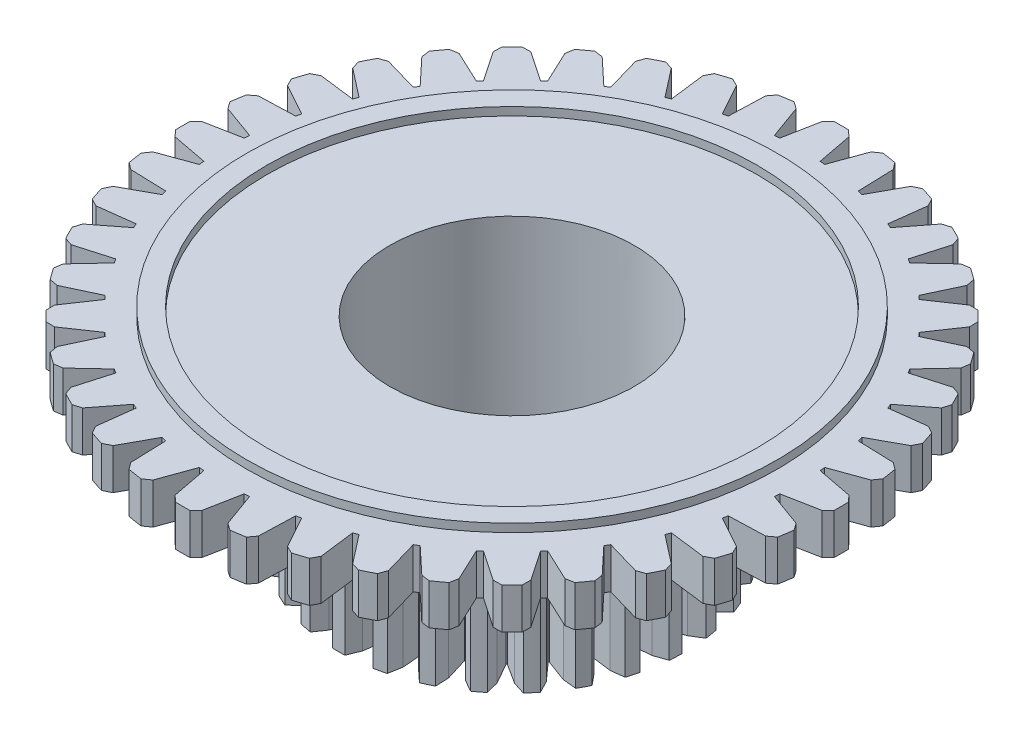
from build123d import *

# Parameters (mm, degrees)
BOSS_EXTRUDE1_DEPTH = 1
SKETCH2_R           = 6.500405198
SKETCH2_R_2         = 6.000405198
BOSS_EXTRUDE2_DEPTH = 0.2
SKETCH4_R           = 2.995
CUT_EXTRUDE3_DEPTH  = 4.2
SKETCH6_R           = 2.995
BOSS_EXTRUDE4_DEPTH = 4


with BuildPart() as part:
    # Sketch1 → Boss-Extrude1 (new body)
    with BuildSketch(Plane(origin=(0, 0, 0), x_dir=(1, 0, 0), z_dir=(0, 1, 0))):
        with BuildLine():
            Line((-0.176242376, 8.068075274), (-0.326242376, 7.922481316))
            Line((-0.326242376, 7.922481316), (-0.493178269, 7.052777835))
            ThreePointArc((-0.493178269, 7.052777835), (-0.554705807, 7.048205549), (-0.616191101, 7.043096516))
            Line((-0.616191101, 7.043096516), (-0.917123335, 7.875977976))
            Line((-0.917123335, 7.875977976), (-1.088052499, 7.996314261))
            ThreePointArc((-1.088052499, 7.996314261), (-1.262426133, 7.970644909), (-1.43619758, 7.941173497))
            Line((-1.43619758, 7.941173497), (-1.561574918, 7.773906872))
            Line((-1.561574918, 7.773906872), (-1.590403954, 6.888796358))
            ThreePointArc((-1.590403954, 6.888796358), (-1.650458722, 6.874655337), (-1.710387802, 6.859990785))
            Line((-1.710387802, 6.859990785), (-2.137906426, 7.635541919))
            Line((-2.137906426, 7.635541919), (-2.325555911, 7.727657453))
            ThreePointArc((-2.325555911, 7.727657453), (-2.493767145, 7.675026087), (-2.660788832, 7.618733674))
            Line((-2.660788832, 7.618733674), (-2.758456302, 7.433913042))
            Line((-2.758456302, 7.433913042), (-2.648468615, 6.555189852))
            ThreePointArc((-2.648468615, 6.555189852), (-2.705571867, 6.531828295), (-2.762469078, 6.507969314))
            Line((-2.762469078, 6.507969314), (-3.306047166, 7.207093479))
            Line((-3.306047166, 7.207093479), (-3.505796418, 7.268720071))
            ThreePointArc((-3.505796418, 7.268720071), (-3.663703333, 7.19042265), (-3.819862633, 7.108695342))
            Line((-3.819862633, 7.108695342), (-3.887415337, 6.910871601))
            Line((-3.887415337, 6.910871601), (-3.64131919, 6.060172816))
            ThreePointArc((-3.64131919, 6.060172816), (-3.694064853, 6.028165962), (-3.746529198, 5.99570004))
            Line((-3.746529198, 5.99570004), (-4.392782052, 6.601182479))
            Line((-4.392782052, 6.601182479), (-4.599712583, 6.630802678))
            ThreePointArc((-4.599712583, 6.630802678), (-4.743426986, 6.528767145), (-4.884878738, 6.423617339))
            Line((-4.884878738, 6.423617339), (-4.920653306, 6.217661565))
            Line((-4.920653306, 6.217661565), (-4.5445084, 5.415934213))
            ThreePointArc((-4.5445084, 5.415934213), (-4.591597702, 5.376070177), (-4.638337335, 5.335796732))
            Line((-4.638337335, 5.335796732), (-5.371352066, 5.832728459))
            Line((-5.371352066, 5.832728459), (-5.580368558, 5.829612917))
            ThreePointArc((-5.580368558, 5.829612917), (-5.706351724, 5.706351724), (-5.829612917, 5.580368558))
            Line((-5.829612917, 5.580368558), (-5.832728459, 5.371352066))
            Line((-5.832728459, 5.371352066), (-5.335796732, 4.638337335))
            ThreePointArc((-5.335796732, 4.638337335), (-5.376070177, 4.591597702), (-5.415934213, 4.5445084))
            Line((-5.415934213, 4.5445084), (-6.217661565, 4.920653306))
            Line((-6.217661565, 4.920653306), (-6.423617339, 4.884878738))
            ThreePointArc((-6.423617339, 4.884878738), (-6.528767145, 4.743426986), (-6.630802678, 4.599712583))
            Line((-6.630802678, 4.599712583), (-6.601182479, 4.392782052))
            Line((-6.601182479, 4.392782052), (-5.99570004, 3.746529198))
            ThreePointArc((-5.99570004, 3.746529198), (-6.028165962, 3.694064853), (-6.060172816, 3.64131919))
            Line((-6.060172816, 3.64131919), (-6.910871601, 3.887415337))
            Line((-6.910871601, 3.887415337), (-7.108695342, 3.819862633))
            ThreePointArc((-7.108695342, 3.819862633), (-7.19042265, 3.663703333), (-7.268720071, 3.505796418))
            Line((-7.268720071, 3.505796418), (-7.207093479, 3.306047166))
            Line((-7.207093479, 3.306047166), (-6.507969314, 2.762469078))
            ThreePointArc((-6.507969314, 2.762469078), (-6.531828295, 2.705571867), (-6.555189852, 2.648468615))
            Line((-6.555189852, 2.648468615), (-7.433913042, 2.758456302))
            Line((-7.433913042, 2.758456302), (-7.618733674, 2.660788832))
            ThreePointArc((-7.618733674, 2.660788832), (-7.675026087, 2.493767145), (-7.727657453, 2.325555911))
            Line((-7.727657453, 2.325555911), (-7.635541919, 2.137906426))
            Line((-7.635541919, 2.137906426), (-6.859990785, 1.710387802))
            ThreePointArc((-6.859990785, 1.710387802), (-6.874655337, 1.650458722), (-6.888796358, 1.590403954))
            Line((-6.888796358, 1.590403954), (-7.773906872, 1.561574918))
            Line((-7.773906872, 1.561574918), (-7.941173497, 1.43619758))
            ThreePointArc((-7.941173497, 1.43619758), (-7.970644909, 1.262426133), (-7.996314261, 1.088052499))
            Line((-7.996314261, 1.088052499), (-7.875977976, 0.917123335))
            Line((-7.875977976, 0.917123335), (-7.043096516, 0.616191101))
            ThreePointArc((-7.043096516, 0.616191101), (-7.048205549, 0.554705807), (-7.052777835, 0.493178269))
            Line((-7.052777835, 0.493178269), (-7.922481316, 0.326242376))
            Line((-7.922481316, 0.326242376), (-8.068075274, 0.176242376))
            ThreePointArc((-8.068075274, 0.176242376), (-8.07, 0), (-8.068075274, -0.176242376))
            Line((-8.068075274, -0.176242376), (-7.922481316, -0.326242376))
            Line((-7.922481316, -0.326242376), (-7.052777835, -0.493178269))
            ThreePointArc((-7.052777835, -0.493178269), (-7.048205549, -0.554705807), (-7.043096516, -0.616191101))
            Line((-7.043096516, -0.616191101), (-7.875977976, -0.917123335))
            Line((-7.875977976, -0.917123335), (-7.996314261, -1.088052499))
            ThreePointArc((-7.996314261, -1.088052499), (-7.970644909, -1.262426133), (-7.941173497, -1.43619758))
            Line((-7.941173497, -1.43619758), (-7.773906872, -1.561574918))
            Line((-7.773906872, -1.561574918), (-6.888796358, -1.590403954))
            ThreePointArc((-6.888796358, -1.590403954), (-6.874655337, -1.650458722), (-6.859990785, -1.710387802))
            Line((-6.859990785, -1.710387802), (-7.635541919, -2.137906426))
            Line((-7.635541919, -2.137906426), (-7.727657453, -2.325555911))
            ThreePointArc((-7.727657453, -2.325555911), (-7.675026087, -2.493767145), (-7.618733674, -2.660788832))
            Line((-7.618733674, -2.660788832), (-7.433913042, -2.758456302))
            Line((-7.433913042, -2.758456302), (-6.555189852, -2.648468615))
            ThreePointArc((-6.555189852, -2.648468615), (-6.531828295, -2.705571867), (-6.507969314, -2.762469078))
            Line((-6.507969314, -2.762469078), (-7.207093479, -3.306047166))
            Line((-7.207093479, -3.306047166), (-7.268720071, -3.505796418))
            ThreePointArc((-7.268720071, -3.505796418), (-7.19042265, -3.663703333), (-7.108695342, -3.819862633))
            Line((-7.108695342, -3.819862633), (-6.910871601, -3.887415337))
            Line((-6.910871601, -3.887415337), (-6.060172816, -3.64131919))
            ThreePointArc((-6.060172816, -3.64131919), (-6.028165962, -3.694064853), (-5.99570004, -3.746529198))
            Line((-5.99570004, -3.746529198), (-6.601182479, -4.392782052))
            Line((-6.601182479, -4.392782052), (-6.630802678, -4.599712583))
            ThreePointArc((-6.630802678, -4.599712583), (-6.528767145, -4.743426986), (-6.423617339, -4.884878738))
            Line((-6.423617339, -4.884878738), (-6.217661565, -4.920653306))
            Line((-6.217661565, -4.920653306), (-5.415934213, -4.5445084))
            ThreePointArc((-5.415934213, -4.5445084), (-5.376070177, -4.591597702), (-5.335796732, -4.638337335))
            Line((-5.335796732, -4.638337335), (-5.832728459, -5.371352066))
            Line((-5.832728459, -5.371352066), (-5.829612917, -5.580368558))
            ThreePointArc((-5.829612917, -5.580368558), (-5.706351724, -5.706351724), (-5.580368558, -5.829612917))
            Line((-5.580368558, -5.829612917), (-5.371352066, -5.832728459))
            Line((-5.371352066, -5.832728459), (-4.638337335, -5.335796732))
            ThreePointArc((-4.638337335, -5.335796732), (-4.591597702, -5.376070177), (-4.5445084, -5.415934213))
            Line((-4.5445084, -5.415934213), (-4.920653306, -6.217661565))
            Line((-4.920653306, -6.217661565), (-4.884878738, -6.423617339))
            ThreePointArc((-4.884878738, -6.423617339), (-4.743426986, -6.528767145), (-4.599712583, -6.630802678))
            Line((-4.599712583, -6.630802678), (-4.392782052, -6.601182479))
            Line((-4.392782052, -6.601182479), (-3.746529198, -5.99570004))
            ThreePointArc((-3.746529198, -5.99570004), (-3.694064853, -6.028165962), (-3.64131919, -6.060172816))
            Line((-3.64131919, -6.060172816), (-3.887415337, -6.910871601))
            Line((-3.887415337, -6.910871601), (-3.819862633, -7.108695342))
            ThreePointArc((-3.819862633, -7.108695342), (-3.663703333, -7.19042265), (-3.505796418, -7.268720071))
            Line((-3.505796418, -7.268720071), (-3.306047166, -7.207093479))
            Line((-3.306047166, -7.207093479), (-2.762469078, -6.507969314))
            ThreePointArc((-2.762469078, -6.507969314), (-2.705571867, -6.531828295), (-2.648468615, -6.555189852))
            Line((-2.648468615, -6.555189852), (-2.758456302, -7.433913042))
            Line((-2.758456302, -7.433913042), (-2.660788832, -7.618733674))
            ThreePointArc((-2.660788832, -7.618733674), (-2.493767145, -7.675026087), (-2.325555911, -7.727657453))
            Line((-2.325555911, -7.727657453), (-2.137906426, -7.635541919))
            Line((-2.137906426, -7.635541919), (-1.710387802, -6.859990785))
            ThreePointArc((-1.710387802, -6.859990785), (-1.650458722, -6.874655337), (-1.590403954, -6.888796358))
            Line((-1.590403954, -6.888796358), (-1.561574918, -7.773906872))
            Line((-1.561574918, -7.773906872), (-1.43619758, -7.941173497))
            ThreePointArc((-1.43619758, -7.941173497), (-1.262426133, -7.970644909), (-1.088052499, -7.996314261))
            Line((-1.088052499, -7.996314261), (-0.917123335, -7.875977976))
            Line((-0.917123335, -7.875977976), (-0.616191101, -7.043096516))
            ThreePointArc((-0.616191101, -7.043096516), (-0.554705807, -7.048205549), (-0.493178269, -7.052777835))
            Line((-0.493178269, -7.052777835), (-0.326242376, -7.922481316))
            Line((-0.326242376, -7.922481316), (-0.176242376, -8.068075274))
            ThreePointArc((-0.176242376, -8.068075274), (0, -8.07), (0.176242376, -8.068075274))
            Line((0.176242376, -8.068075274), (0.326242376, -7.922481316))
            Line((0.326242376, -7.922481316), (0.493178269, -7.052777835))
            ThreePointArc((0.493178269, -7.052777835), (0.554705807, -7.048205549), (0.616191101, -7.043096516))
            Line((0.616191101, -7.043096516), (0.917123335, -7.875977976))
            Line((0.917123335, -7.875977976), (1.088052499, -7.996314261))
            ThreePointArc((1.088052499, -7.996314261), (1.262426133, -7.970644909), (1.43619758, -7.941173497))
            Line((1.43619758, -7.941173497), (1.561574918, -7.773906872))
            Line((1.561574918, -7.773906872), (1.590403954, -6.888796358))
            ThreePointArc((1.590403954, -6.888796358), (1.650458722, -6.874655337), (1.710387802, -6.859990785))
            Line((1.710387802, -6.859990785), (2.137906426, -7.635541919))
            Line((2.137906426, -7.635541919), (2.325555911, -7.727657453))
            ThreePointArc((2.325555911, -7.727657453), (2.493767145, -7.675026087), (2.660788832, -7.618733674))
            Line((2.660788832, -7.618733674), (2.758456302, -7.433913042))
            Line((2.758456302, -7.433913042), (2.648468615, -6.555189852))
            ThreePointArc((2.648468615, -6.555189852), (2.705571867, -6.531828295), (2.762469078, -6.507969314))
            Line((2.762469078, -6.507969314), (3.306047166, -7.207093479))
            Line((3.306047166, -7.207093479), (3.505796418, -7.268720071))
            ThreePointArc((3.505796418, -7.268720071), (3.663703333, -7.19042265), (3.819862633, -7.108695342))
            Line((3.819862633, -7.108695342), (3.887415337, -6.910871601))
            Line((3.887415337, -6.910871601), (3.64131919, -6.060172816))
            ThreePointArc((3.64131919, -6.060172816), (3.694064853, -6.028165962), (3.746529198, -5.99570004))
            Line((3.746529198, -5.99570004), (4.392782052, -6.601182479))
            Line((4.392782052, -6.601182479), (4.599712583, -6.630802678))
            ThreePointArc((4.599712583, -6.630802678), (4.743426986, -6.528767145), (4.884878738, -6.423617339))
            Line((4.884878738, -6.423617339), (4.920653306, -6.217661565))
            Line((4.920653306, -6.217661565), (4.5445084, -5.415934213))
            ThreePointArc((4.5445084, -5.415934213), (4.591597702, -5.376070177), (4.638337335, -5.335796732))
            Line((4.638337335, -5.335796732), (5.371352066, -5.832728459))
            Line((5.371352066, -5.832728459), (5.580368558, -5.829612917))
            ThreePointArc((5.580368558, -5.829612917), (5.706351724, -5.706351724), (5.829612917, -5.580368558))
            Line((5.829612917, -5.580368558), (5.832728459, -5.371352066))
            Line((5.832728459, -5.371352066), (5.335796732, -4.638337335))
            ThreePointArc((5.335796732, -4.638337335), (5.376070177, -4.591597702), (5.415934213, -4.5445084))
            Line((5.415934213, -4.5445084), (6.217661565, -4.920653306))
            Line((6.217661565, -4.920653306), (6.423617339, -4.884878738))
            ThreePointArc((6.423617339, -4.884878738), (6.528767145, -4.743426986), (6.630802678, -4.599712583))
            Line((6.630802678, -4.599712583), (6.601182479, -4.392782052))
            Line((6.601182479, -4.392782052), (5.99570004, -3.746529198))
            ThreePointArc((5.99570004, -3.746529198), (6.028165962, -3.694064853), (6.060172816, -3.64131919))
            Line((6.060172816, -3.64131919), (6.910871601, -3.887415337))
            Line((6.910871601, -3.887415337), (7.108695342, -3.819862633))
            ThreePointArc((7.108695342, -3.819862633), (7.19042265, -3.663703333), (7.268720071, -3.505796418))
            Line((7.268720071, -3.505796418), (7.207093479, -3.306047166))
            Line((7.207093479, -3.306047166), (6.507969314, -2.762469078))
            ThreePointArc((6.507969314, -2.762469078), (6.531828295, -2.705571867), (6.555189852, -2.648468615))
            Line((6.555189852, -2.648468615), (7.433913042, -2.758456302))
            Line((7.433913042, -2.758456302), (7.618733674, -2.660788832))
            ThreePointArc((7.618733674, -2.660788832), (7.675026087, -2.493767145), (7.727657453, -2.325555911))
            Line((7.727657453, -2.325555911), (7.635541919, -2.137906426))
            Line((7.635541919, -2.137906426), (6.859990785, -1.710387802))
            ThreePointArc((6.859990785, -1.710387802), (6.874655337, -1.650458722), (6.888796358, -1.590403954))
            Line((6.888796358, -1.590403954), (7.773906872, -1.561574918))
            Line((7.773906872, -1.561574918), (7.941173497, -1.43619758))
            ThreePointArc((7.941173497, -1.43619758), (7.970644909, -1.262426133), (7.996314261, -1.088052499))
            Line((7.996314261, -1.088052499), (7.875977976, -0.917123335))
            Line((7.875977976, -0.917123335), (7.043096516, -0.616191101))
            ThreePointArc((7.043096516, -0.616191101), (7.048205549, -0.554705807), (7.052777835, -0.493178269))
            Line((7.052777835, -0.493178269), (7.922481316, -0.326242376))
            Line((7.922481316, -0.326242376), (8.068075274, -0.176242376))
            ThreePointArc((8.068075274, -0.176242376), (8.07, 0), (8.068075274, 0.176242376))
            Line((8.068075274, 0.176242376), (7.922481316, 0.326242376))
            Line((7.922481316, 0.326242376), (7.052777835, 0.493178269))
            ThreePointArc((7.052777835, 0.493178269), (7.048205549, 0.554705807), (7.043096516, 0.616191101))
            Line((7.043096516, 0.616191101), (7.875977976, 0.917123335))
            Line((7.875977976, 0.917123335), (7.996314261, 1.088052499))
            ThreePointArc((7.996314261, 1.088052499), (7.970644909, 1.262426133), (7.941173497, 1.43619758))
            Line((7.941173497, 1.43619758), (7.773906872, 1.561574918))
            Line((7.773906872, 1.561574918), (6.888796358, 1.590403954))
            ThreePointArc((6.888796358, 1.590403954), (6.874655337, 1.650458722), (6.859990785, 1.710387802))
            Line((6.859990785, 1.710387802), (7.635541919, 2.137906426))
            Line((7.635541919, 2.137906426), (7.727657453, 2.325555911))
            ThreePointArc((7.727657453, 2.325555911), (7.675026087, 2.493767145), (7.618733674, 2.660788832))
            Line((7.618733674, 2.660788832), (7.433913042, 2.758456302))
            Line((7.433913042, 2.758456302), (6.555189852, 2.648468615))
            ThreePointArc((6.555189852, 2.648468615), (6.531828295, 2.705571867), (6.507969314, 2.762469078))
            Line((6.507969314, 2.762469078), (7.207093479, 3.306047166))
            Line((7.207093479, 3.306047166), (7.268720071, 3.505796418))
            ThreePointArc((7.268720071, 3.505796418), (7.19042265, 3.663703333), (7.108695342, 3.819862633))
            Line((7.108695342, 3.819862633), (6.910871601, 3.887415337))
            Line((6.910871601, 3.887415337), (6.060172816, 3.64131919))
            ThreePointArc((6.060172816, 3.64131919), (6.028165962, 3.694064853), (5.99570004, 3.746529198))
            Line((5.99570004, 3.746529198), (6.601182479, 4.392782052))
            Line((6.601182479, 4.392782052), (6.630802678, 4.599712583))
            ThreePointArc((6.630802678, 4.599712583), (6.528767145, 4.743426986), (6.423617339, 4.884878738))
            Line((6.423617339, 4.884878738), (6.217661565, 4.920653306))
            Line((6.217661565, 4.920653306), (5.415934213, 4.5445084))
            ThreePointArc((5.415934213, 4.5445084), (5.376070177, 4.591597702), (5.335796732, 4.638337335))
            Line((5.335796732, 4.638337335), (5.832728459, 5.371352066))
            Line((5.832728459, 5.371352066), (5.829612917, 5.580368558))
            ThreePointArc((5.829612917, 5.580368558), (5.706351724, 5.706351724), (5.580368558, 5.829612917))
            Line((5.580368558, 5.829612917), (5.371352066, 5.832728459))
            Line((5.371352066, 5.832728459), (4.638337335, 5.335796732))
            ThreePointArc((4.638337335, 5.335796732), (4.591597702, 5.376070177), (4.5445084, 5.415934213))
            Line((4.5445084, 5.415934213), (4.920653306, 6.217661565))
            Line((4.920653306, 6.217661565), (4.884878738, 6.423617339))
            ThreePointArc((4.884878738, 6.423617339), (4.743426986, 6.528767145), (4.599712583, 6.630802678))
            Line((4.599712583, 6.630802678), (4.392782052, 6.601182479))
            Line((4.392782052, 6.601182479), (3.746529198, 5.99570004))
            ThreePointArc((3.746529198, 5.99570004), (3.694064853, 6.028165962), (3.64131919, 6.060172816))
            Line((3.64131919, 6.060172816), (3.887415337, 6.910871601))
            Line((3.887415337, 6.910871601), (3.819862633, 7.108695342))
            ThreePointArc((3.819862633, 7.108695342), (3.663703333, 7.19042265), (3.505796418, 7.268720071))
            Line((3.505796418, 7.268720071), (3.306047166, 7.207093479))
            Line((3.306047166, 7.207093479), (2.762469078, 6.507969314))
            ThreePointArc((2.762469078, 6.507969314), (2.705571867, 6.531828295), (2.648468615, 6.555189852))
            Line((2.648468615, 6.555189852), (2.758456302, 7.433913042))
            Line((2.758456302, 7.433913042), (2.660788832, 7.618733674))
            ThreePointArc((2.660788832, 7.618733674), (2.493767145, 7.675026087), (2.325555911, 7.727657453))
            Line((2.325555911, 7.727657453), (2.137906426, 7.635541919))
            Line((2.137906426, 7.635541919), (1.710387802, 6.859990785))
            ThreePointArc((1.710387802, 6.859990785), (1.650458722, 6.874655337), (1.590403954, 6.888796358))
            Line((1.590403954, 6.888796358), (1.561574918, 7.773906872))
            Line((1.561574918, 7.773906872), (1.43619758, 7.941173497))
            ThreePointArc((1.43619758, 7.941173497), (1.262426133, 7.970644909), (1.088052499, 7.996314261))
            Line((1.088052499, 7.996314261), (0.917123335, 7.875977976))
            Line((0.917123335, 7.875977976), (0.616191101, 7.043096516))
            ThreePointArc((0.616191101, 7.043096516), (0.554705807, 7.048205549), (0.493178269, 7.052777835))
            Line((0.493178269, 7.052777835), (0.326242376, 7.922481316))
            Line((0.326242376, 7.922481316), (0.176242376, 8.068075274))
            ThreePointArc((0.176242376, 8.068075274), (0, 8.07), (-0.176242376, 8.068075274))
        make_face()
    extrude(amount=BOSS_EXTRUDE1_DEPTH)

    # Sketch2 → Boss-Extrude2 (add)
    with BuildSketch(Plane(origin=(0, 1, 0), x_dir=(1, 0, 0), z_dir=(0, 1, 0))):
        with Locations(Location((0, 0, 0), (0, 0, 270))):
            Circle(SKETCH2_R)
        with Locations(Location((0, 0, 0), (0, 0, 270))):
            Circle(SKETCH2_R_2, mode=Mode.SUBTRACT)
    extrude(amount=BOSS_EXTRUDE2_DEPTH)

    # Sketch4 → Cut-Extrude3 (cut)
    with BuildSketch(Plane(origin=(0, 1, 0), x_dir=(1, 0, 0), z_dir=(0, 1, 0))):
        with Locations(Location((0, 0, 0), (0, 0, 270))):
            Circle(SKETCH4_R)
    extrude(amount=-CUT_EXTRUDE3_DEPTH, mode=Mode.SUBTRACT)

    # Sketch6 → Boss-Extrude4 (add)
    with BuildSketch(Plane.XZ):
        with BuildLine():
            Line((0.148148364, 4.242414061), (0.275189289, 3.935390178))
            Line((0.275189289, 3.935390178), (0.354610282, 3.357133897))
            ThreePointArc((0.354610282, 3.357133897), (0.364989316, 3.356021343), (0.375364861, 3.354876701))
            Line((0.375364861, 3.354876701), (0.577237043, 3.902540505))
            Line((0.577237043, 3.902540505), (0.767308881, 4.175076296))
            ThreePointArc((0.767308881, 4.175076296), (0.912549519, 4.145754259), (1.056678355, 4.111381259))
            Line((1.056678355, 4.111381259), (1.114748075, 3.78422538))
            Line((1.114748075, 3.78422538), (1.068004243, 3.202415244))
            ThreePointArc((1.068004243, 3.202415244), (1.077901455, 3.199097515), (1.08778836, 3.195749198))
            Line((1.08778836, 3.195749198), (1.402672412, 3.687212376))
            Line((1.402672412, 3.687212376), (1.646887615, 3.912516605))
            ThreePointArc((1.646887615, 3.912516605), (1.782429236, 3.852657657), (1.915799242, 3.788104838))
            Line((1.915799242, 3.788104838), (1.902182481, 3.456114409))
            Line((1.902182481, 3.456114409), (1.731459512, 2.897955213))
            ThreePointArc((1.731459512, 2.897955213), (1.740412119, 2.892587443), (1.749348085, 2.887192015))
            Line((1.749348085, 2.887192015), (2.162520378, 3.299474294))
            Line((2.162520378, 3.299474294), (2.449459715, 3.467011985))
            ThreePointArc((2.449459715, 3.467011985), (2.568964543, 3.379415064), (2.685339485, 3.287700846))
            Line((2.685339485, 3.287700846), (2.600672947, 2.96639937))
            Line((2.600672947, 2.96639937), (2.313953658, 2.457990017))
            ThreePointArc((2.313953658, 2.457990017), (2.321543046, 2.450823196), (2.329110237, 2.443632943))
            Line((2.329110237, 2.443632943), (2.821251295, 2.757456461))
            Line((2.821251295, 2.757456461), (3.137497801, 2.859393738))
            ThreePointArc((3.137497801, 2.859393738), (3.235377924, 2.748154779), (3.329316238, 2.633567616))
            Line((3.329316238, 2.633567616), (3.177558837, 2.337978793))
            Line((3.177558837, 2.337978793), (2.788249904, 1.90309194))
            ThreePointArc((2.788249904, 1.90309194), (2.794121201, 1.894461181), (2.799965784, 1.885812309))
            Line((2.799965784, 1.885812309), (3.348063636, 2.086503028))
            Line((3.348063636, 2.086503028), (3.678829976, 2.118073418))
            ThreePointArc((3.678829976, 2.118073418), (3.750508629, 1.988393831), (3.817617864, 1.856291691))
            Line((3.817617864, 1.856291691), (3.605865608, 1.600236926))
            Line((3.605865608, 1.600236926), (3.132170682, 1.259207399))
            ThreePointArc((3.132170682, 1.259207399), (3.136049355, 1.249516267), (3.139898042, 1.239813189))
            Line((3.139898042, 1.239813189), (3.718324244, 1.317987033))
            Line((3.718324244, 1.317987033), (4.048144151, 1.27771434))
            ThreePointArc((4.048144151, 1.27771434), (4.090269718, 1.135657797), (4.127411922, 0.99221763))
            Line((4.127411922, 0.99221763), (3.86556611, 0.787669759))
            Line((3.86556611, 0.787669759), (3.329634641, 0.556443719))
            ThreePointArc((3.329634641, 0.556443719), (3.331339325, 0.546145361), (3.333012157, 0.535841781))
            Line((3.333012157, 0.535841781), (3.914720142, 0.487843429))
            Line((3.914720142, 0.487843429), (4.228171604, 0.377610758))
            ThreePointArc((4.228171604, 0.377610758), (4.238774342, 0.229819667), (4.244212786, 0.081748576))
            Line((4.244212786, 0.081748576), (3.944517037, -0.061727971))
            Line((3.944517037, -0.061727971), (3.371408585, -0.172338651))
            ThreePointArc((3.371408585, -0.172338651), (3.370859572, -0.182762695), (3.370278329, -0.193184993))
            Line((3.370278329, -0.193184993), (3.928068077, -0.365111191))
            Line((3.928068077, -0.365111191), (4.210494453, -0.540149483))
            ThreePointArc((4.210494453, -0.540149483), (4.189078588, -0.686764575), (4.162558977, -0.832542951))
            Line((4.162558977, -0.832542951), (3.839026732, -0.908239369))
            Line((3.839026732, -0.908239369), (3.25553921, -0.893062656))
            ThreePointArc((3.25553921, -0.893062656), (3.252762171, -0.903124971), (3.249954032, -0.913178651))
            Line((3.249954032, -0.913178651), (3.757743915, -1.200993618))
            Line((3.757743915, -1.200993618), (3.99593926, -1.432652934))
            ThreePointArc((3.99593926, -1.432652934), (3.943506176, -1.571236469), (3.886268536, -1.707905695))
            Line((3.886268536, -1.707905695), (3.554027803, -1.712282504))
            Line((3.554027803, -1.712282504), (2.98744444, -1.572028045))
            ThreePointArc((2.98744444, -1.572028045), (2.982569227, -1.581258127), (2.977665496, -1.590473091))
            Line((2.977665496, -1.590473091), (3.411711823, -1.980718918))
            Line((3.411711823, -1.980718918), (3.594538389, -2.258167126))
            ThreePointArc((3.594538389, -2.258167126), (3.513539797, -2.382239092), (3.428260498, -2.503408667))
            Line((3.428260498, -2.503408667), (3.102846485, -2.436261212))
            Line((3.102846485, -2.436261212), (2.579660088, -2.177487149))
            ThreePointArc((2.579660088, -2.177487149), (2.57291466, -2.18545341), (2.566144631, -2.193398776))
            Line((2.566144631, -2.193398776), (2.906151879, -2.667828003))
            Line((2.906151879, -2.667828003), (3.025060898, -2.978091934))
            ThreePointArc((3.025060898, -2.978091934), (2.919284203, -3.081850863), (2.80995081, -3.181855032))
            Line((2.80995081, -3.181855032), (2.506579513, -3.046323053))
            Line((2.506579513, -3.046323053), (2.051253698, -2.681129374))
            ThreePointArc((2.051253698, -2.681129374), (2.042953463, -2.687459321), (2.034633695, -2.693763572))
            Line((2.034633695, -2.693763572), (2.264703503, -3.230192416))
            Line((2.264703503, -3.230192416), (2.314134921, -3.558764472))
            ThreePointArc((2.314134921, -3.558764472), (2.188526124, -3.637358713), (2.060250944, -3.711521392))
            Line((2.060250944, -3.711521392), (1.793107669, -3.513942215))
            Line((1.793107669, -3.513942215), (1.426932965, -3.05940497))
            ThreePointArc((1.426932965, -3.05940497), (1.417466033, -3.063802621), (1.407985549, -3.068170978))
            Line((1.407985549, -3.068170978), (1.517360108, -3.641516621))
            Line((1.517360108, -3.641516621), (1.495002568, -3.973033139))
            ThreePointArc((1.495002568, -3.973033139), (1.355434995, -4.022787712), (1.214216035, -4.067641137))
            Line((1.214216035, -4.067641137), (0.995792103, -3.817253343))
            Line((0.995792103, -3.817253343), (0.735890432, -3.294626189))
            ThreePointArc((0.735890432, -3.294626189), (0.725699467, -3.296885915), (0.715501563, -3.299114119))
            Line((0.715501563, -3.299114119), (0.699066641, -3.882567557))
            Line((0.699066641, -3.882567557), (0.605965555, -4.201527192))
            ThreePointArc((0.605965555, -4.201527192), (0.458965233, -4.220115628), (0.311405733, -4.233562503))
            Line((0.311405733, -4.233562503), (0.151914406, -3.942073948))
            Line((0.151914406, -3.942073948), (0.01043848, -3.37579435))
            ThreePointArc((0.01043848, -3.37579435), (0, -3.375810489), (-0.01043848, -3.37579435))
            Line((-0.01043848, -3.37579435), (-0.151914406, -3.942073948))
            Line((-0.151914406, -3.942073948), (-0.311405733, -4.233562503))
            ThreePointArc((-0.311405733, -4.233562503), (-0.458965233, -4.220115628), (-0.605965555, -4.201527192))
            Line((-0.605965555, -4.201527192), (-0.699066641, -3.882567557))
            Line((-0.699066641, -3.882567557), (-0.715501563, -3.299114119))
            ThreePointArc((-0.715501563, -3.299114119), (-0.725699467, -3.296885915), (-0.735890432, -3.294626189))
            Line((-0.735890432, -3.294626189), (-0.995792103, -3.817253343))
            Line((-0.995792103, -3.817253343), (-1.214216035, -4.067641137))
            ThreePointArc((-1.214216035, -4.067641137), (-1.355434995, -4.022787712), (-1.495002568, -3.973033139))
            Line((-1.495002568, -3.973033139), (-1.517360108, -3.641516621))
            Line((-1.517360108, -3.641516621), (-1.407985549, -3.068170978))
            ThreePointArc((-1.407985549, -3.068170978), (-1.417466033, -3.063802621), (-1.426932965, -3.05940497))
            Line((-1.426932965, -3.05940497), (-1.793107669, -3.513942215))
            Line((-1.793107669, -3.513942215), (-2.060250944, -3.711521392))
            ThreePointArc((-2.060250944, -3.711521392), (-2.188526124, -3.637358713), (-2.314134921, -3.558764472))
            Line((-2.314134921, -3.558764472), (-2.264703503, -3.230192416))
            Line((-2.264703503, -3.230192416), (-2.034633695, -2.693763572))
            ThreePointArc((-2.034633695, -2.693763572), (-2.042953463, -2.687459321), (-2.051253698, -2.681129374))
            Line((-2.051253698, -2.681129374), (-2.506579513, -3.046323053))
            Line((-2.506579513, -3.046323053), (-2.80995081, -3.181855032))
            ThreePointArc((-2.80995081, -3.181855032), (-2.919284203, -3.081850863), (-3.025060898, -2.978091934))
            Line((-3.025060898, -2.978091934), (-2.906151879, -2.667828003))
            Line((-2.906151879, -2.667828003), (-2.566144631, -2.193398776))
            ThreePointArc((-2.566144631, -2.193398776), (-2.57291466, -2.18545341), (-2.579660088, -2.177487149))
            Line((-2.579660088, -2.177487149), (-3.102846485, -2.436261212))
            Line((-3.102846485, -2.436261212), (-3.428260498, -2.503408667))
            ThreePointArc((-3.428260498, -2.503408667), (-3.513539797, -2.382239092), (-3.594538389, -2.258167126))
            Line((-3.594538389, -2.258167126), (-3.411711823, -1.980718918))
            Line((-3.411711823, -1.980718918), (-2.977665496, -1.590473091))
            ThreePointArc((-2.977665496, -1.590473091), (-2.982569227, -1.581258127), (-2.98744444, -1.572028045))
            Line((-2.98744444, -1.572028045), (-3.554027803, -1.712282504))
            Line((-3.554027803, -1.712282504), (-3.886268536, -1.707905695))
            ThreePointArc((-3.886268536, -1.707905695), (-3.943506176, -1.571236469), (-3.99593926, -1.432652934))
            Line((-3.99593926, -1.432652934), (-3.757743915, -1.200993618))
            Line((-3.757743915, -1.200993618), (-3.249954032, -0.913178651))
            ThreePointArc((-3.249954032, -0.913178651), (-3.252762171, -0.903124971), (-3.25553921, -0.893062656))
            Line((-3.25553921, -0.893062656), (-3.839026732, -0.908239369))
            Line((-3.839026732, -0.908239369), (-4.162558977, -0.832542951))
            ThreePointArc((-4.162558977, -0.832542951), (-4.189078588, -0.686764575), (-4.210494453, -0.540149483))
            Line((-4.210494453, -0.540149483), (-3.928068077, -0.365111191))
            Line((-3.928068077, -0.365111191), (-3.370278329, -0.193184993))
            ThreePointArc((-3.370278329, -0.193184993), (-3.370859572, -0.182762695), (-3.371408585, -0.172338651))
            Line((-3.371408585, -0.172338651), (-3.944517037, -0.061727971))
            Line((-3.944517037, -0.061727971), (-4.244212786, 0.081748576))
            ThreePointArc((-4.244212786, 0.081748576), (-4.238774342, 0.229819667), (-4.228171604, 0.377610758))
            Line((-4.228171604, 0.377610758), (-3.914720142, 0.487843429))
            Line((-3.914720142, 0.487843429), (-3.333012157, 0.535841781))
            ThreePointArc((-3.333012157, 0.535841781), (-3.331339325, 0.546145361), (-3.329634641, 0.556443719))
            Line((-3.329634641, 0.556443719), (-3.86556611, 0.787669759))
            Line((-3.86556611, 0.787669759), (-4.127411922, 0.99221763))
            ThreePointArc((-4.127411922, 0.99221763), (-4.090269718, 1.135657797), (-4.048144151, 1.27771434))
            Line((-4.048144151, 1.27771434), (-3.718324244, 1.317987033))
            Line((-3.718324244, 1.317987033), (-3.139898042, 1.239813189))
            ThreePointArc((-3.139898042, 1.239813189), (-3.136049355, 1.249516267), (-3.132170682, 1.259207399))
            Line((-3.132170682, 1.259207399), (-3.605865608, 1.600236926))
            Line((-3.605865608, 1.600236926), (-3.817617864, 1.856291691))
            ThreePointArc((-3.817617864, 1.856291691), (-3.750508629, 1.988393831), (-3.678829976, 2.118073418))
            Line((-3.678829976, 2.118073418), (-3.348063636, 2.086503028))
            Line((-3.348063636, 2.086503028), (-2.799965784, 1.885812309))
            ThreePointArc((-2.799965784, 1.885812309), (-2.794121201, 1.894461181), (-2.788249904, 1.90309194))
            Line((-2.788249904, 1.90309194), (-3.177558837, 2.337978793))
            Line((-3.177558837, 2.337978793), (-3.329316238, 2.633567616))
            ThreePointArc((-3.329316238, 2.633567616), (-3.235377924, 2.748154779), (-3.137497801, 2.859393738))
            Line((-3.137497801, 2.859393738), (-2.821251295, 2.757456461))
            Line((-2.821251295, 2.757456461), (-2.329110237, 2.443632943))
            ThreePointArc((-2.329110237, 2.443632943), (-2.321543046, 2.450823196), (-2.313953658, 2.457990017))
            Line((-2.313953658, 2.457990017), (-2.600672947, 2.96639937))
            Line((-2.600672947, 2.96639937), (-2.685339485, 3.287700846))
            ThreePointArc((-2.685339485, 3.287700846), (-2.568964543, 3.379415064), (-2.449459715, 3.467011985))
            Line((-2.449459715, 3.467011985), (-2.162520378, 3.299474294))
            Line((-2.162520378, 3.299474294), (-1.749348085, 2.887192015))
            ThreePointArc((-1.749348085, 2.887192015), (-1.740412119, 2.892587443), (-1.731459512, 2.897955213))
            Line((-1.731459512, 2.897955213), (-1.902182481, 3.456114409))
            Line((-1.902182481, 3.456114409), (-1.915799242, 3.788104838))
            ThreePointArc((-1.915799242, 3.788104838), (-1.782429236, 3.852657657), (-1.646887615, 3.912516605))
            Line((-1.646887615, 3.912516605), (-1.402672412, 3.687212376))
            Line((-1.402672412, 3.687212376), (-1.08778836, 3.195749198))
            ThreePointArc((-1.08778836, 3.195749198), (-1.077901455, 3.199097515), (-1.068004243, 3.202415244))
            Line((-1.068004243, 3.202415244), (-1.114748075, 3.78422538))
            Line((-1.114748075, 3.78422538), (-1.056678355, 4.111381259))
            ThreePointArc((-1.056678355, 4.111381259), (-0.912549519, 4.145754259), (-0.767308881, 4.175076296))
            Line((-0.767308881, 4.175076296), (-0.577237043, 3.902540505))
            Line((-0.577237043, 3.902540505), (-0.375364861, 3.354876701))
            ThreePointArc((-0.375364861, 3.354876701), (-0.364989316, 3.356021343), (-0.354610282, 3.357133897))
            Line((-0.354610282, 3.357133897), (-0.275189289, 3.935390178))
            Line((-0.275189289, 3.935390178), (-0.148148364, 4.242414061))
            ThreePointArc((-0.148148364, 4.242414061), (0, 4.245), (0.148148364, 4.242414061))
        make_face()
        with Locations(Location((0, 0, 0), (0, 0, 90))):
            Circle(SKETCH6_R, mode=Mode.SUBTRACT)
    extrude(amount=BOSS_EXTRUDE4_DEPTH)


solid = part.part
